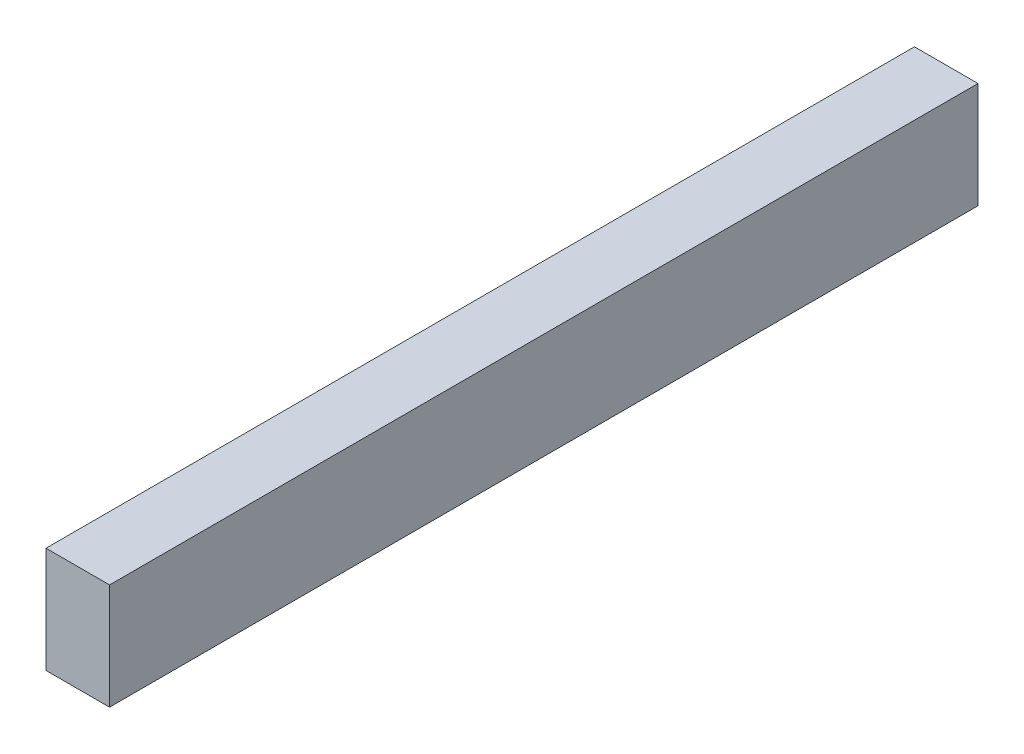
from build123d import *

# Parameters (mm, degrees)
ESQUISSE1_W        = 30
ESQUISSE1_H        = 50
BOSS_EXTRU_1_DEPTH = 410


with BuildPart() as part:
    # Esquisse1 → Boss.-Extru.1 (new body)
    with BuildSketch(Plane.XY):
        with Locations((15, 25)):
            Rectangle(ESQUISSE1_W, ESQUISSE1_H)
    extrude(amount=BOSS_EXTRU_1_DEPTH)


solid = part.part
